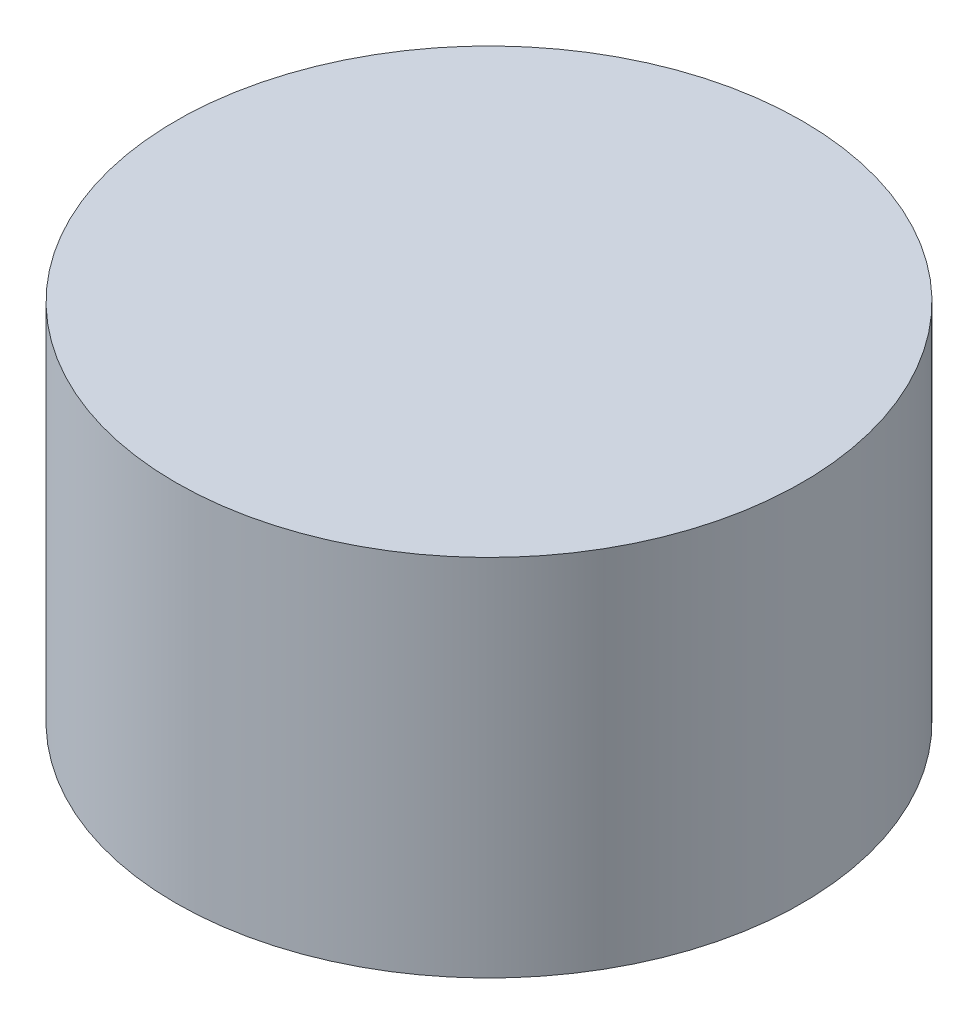
from build123d import *

# Parameters (mm, degrees)
SKETCH1_R           = 4.3
BOSS_EXTRUDE1_DEPTH = 5


with BuildPart() as part:
    # Sketch1 → Boss-Extrude1 (new body)
    with BuildSketch(Plane(origin=(0, 0, 0), x_dir=(1, 0, 0), z_dir=(0, 1, 0))):
        with Locations(Location((0, 0, 0), (0, 0, 270))):
            Circle(SKETCH1_R)
    extrude(amount=BOSS_EXTRUDE1_DEPTH)


solid = part.part
